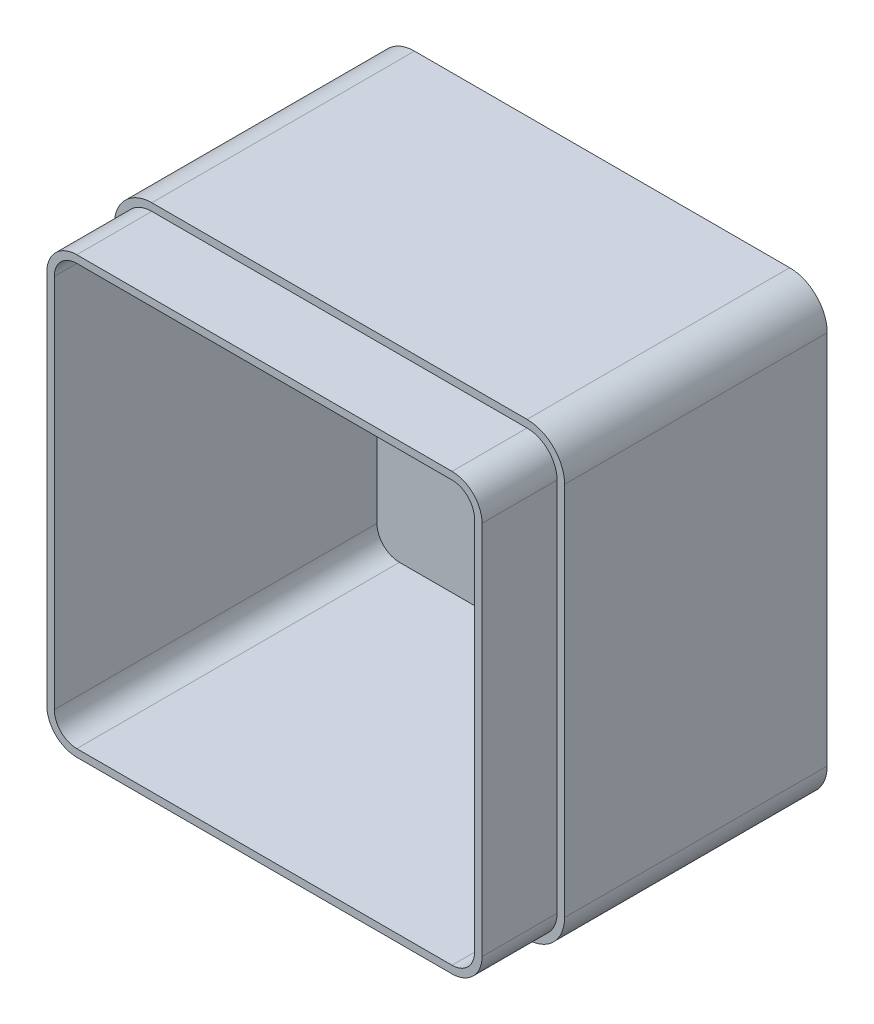
from build123d import *

# Parameters (mm, degrees)
SKETCH1_W           = 120
SKETCH1_H           = 120
BOSS_EXTRUDE1_DEPTH = 90
FILLET1_R           = 10
SHELL1_T            = -4
CUT_EXTRUDE1_DEPTH  = 20


with BuildPart() as part:
    # Sketch1 → Boss-Extrude1 (new body)
    with BuildSketch(Plane.XY):
        with Locations((60, 60)):
            Rectangle(SKETCH1_W, SKETCH1_H)
    extrude(amount=BOSS_EXTRUDE1_DEPTH)

    # Fillet1
    fillet1_edges = [part.edges().sort_by_distance(p)[0] for p in [
        (0, 120, 45),
        (120, 120, 45),
        (120, 0, 45),
        (0, 0, 45),
    ]]
    fillet(fillet1_edges, radius=FILLET1_R)

    # Shell1
    shell1_openings = [part.faces().sort_by_distance(p)[0] for p in [
        (60, 60, 90),
    ]]
    offset(amount=SHELL1_T, openings=shell1_openings, kind=Kind.INTERSECTION)

    # Sketch2 → Cut-Extrude1 (cut)
    with BuildSketch(Plane.XY.offset(90)):
        with BuildLine():
            Line((0, 110), (0, 10))
            ThreePointArc((0, 10), (2.928932188, 2.928932188), (10, 0))
            Line((10, 0), (110, 0))
            ThreePointArc((110, 0), (117.071067812, 2.928932188), (120, 10))
            Line((120, 10), (120, 110))
            ThreePointArc((120, 110), (117.071067812, 117.071067812), (110, 120))
            Line((110, 120), (10, 120))
            ThreePointArc((10, 120), (2.928932188, 117.071067812), (0, 110))
        make_face()
        with BuildLine():
            Line((110, 118), (10, 118))
            ThreePointArc((10, 118), (4.343145751, 115.656854249), (2, 110))
            Line((2, 110), (2, 10))
            ThreePointArc((2, 10), (4.343145751, 4.343145751), (10, 2))
            Line((10, 2), (110, 2))
            ThreePointArc((110, 2), (115.656854249, 4.343145751), (118, 10))
            Line((118, 10), (118, 110))
            ThreePointArc((118, 110), (115.656854249, 115.656854249), (110, 118))
        make_face(mode=Mode.SUBTRACT)
    extrude(amount=-CUT_EXTRUDE1_DEPTH, mode=Mode.SUBTRACT)


solid = part.part
